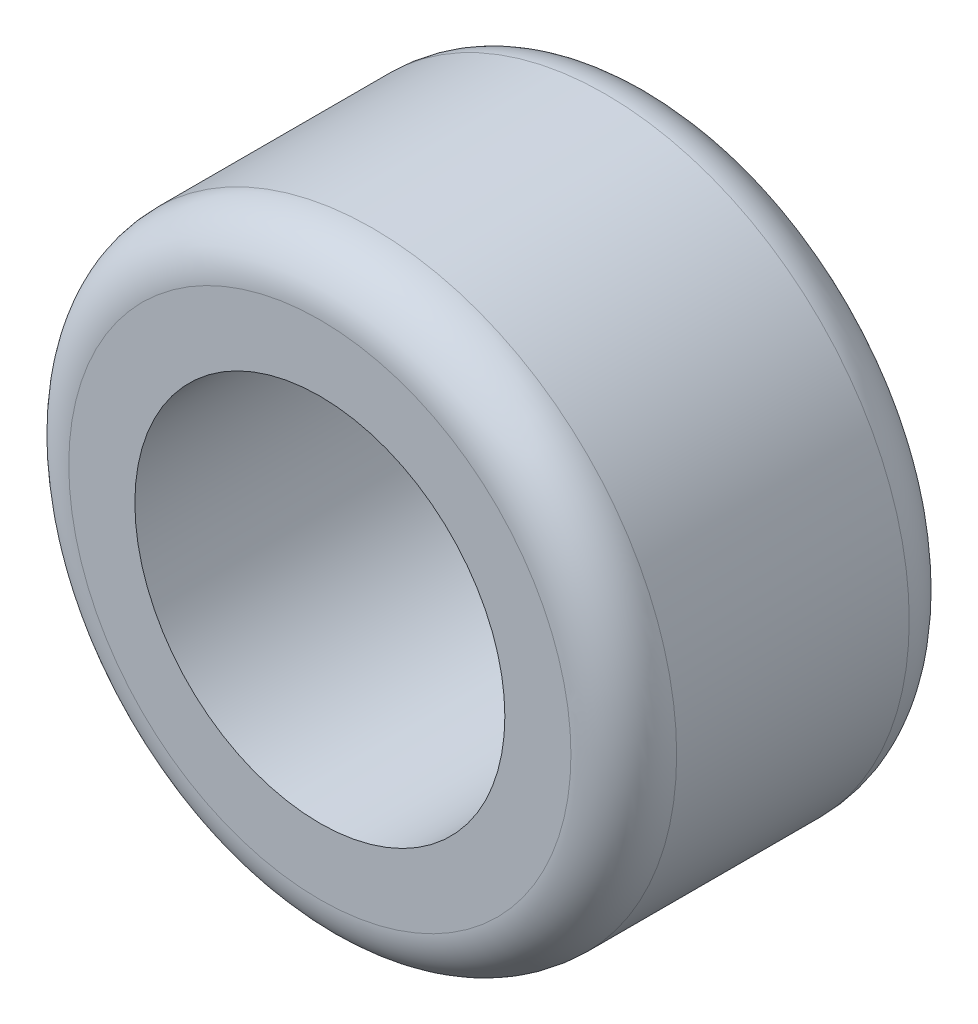
from build123d import *

# Parameters (mm, degrees)
SKETCH1_R           = 73.025
SKETCH1_R_2         = 44.45
BOSS_EXTRUDE1_DEPTH = 40.64
FILLET1_R           = 12.7


with BuildPart() as part:
    # Sketch1 → Boss-Extrude1 (new, symmetric)
    with BuildSketch(Plane.XY):
        Circle(SKETCH1_R)
        Circle(SKETCH1_R_2, mode=Mode.SUBTRACT)
    extrude(amount=BOSS_EXTRUDE1_DEPTH, both=True)

    # Fillet1
    fillet1_edges = [part.edges().sort_by_distance(p)[0] for p in [
        (-73.025, 0, -40.64),
        (-73.025, 0, 40.64),
    ]]
    fillet(fillet1_edges, radius=FILLET1_R)


solid = part.part
